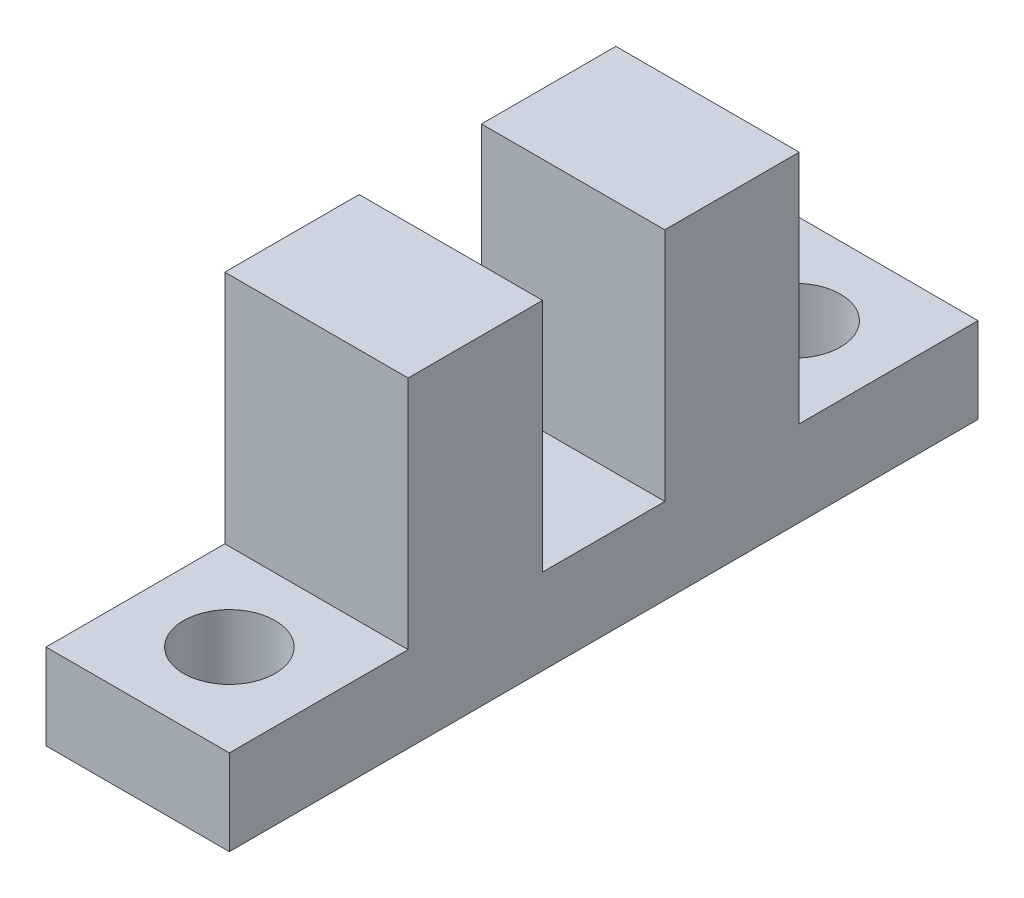
from build123d import *

# Parameters (mm, degrees)
EXTRUDE_1_DEPTH     = 6
SKETCH_2_R          = 1.5
CUT_EXTRUDE_1_DEPTH = 16.663731995


with BuildPart() as part:
    # 草圖1 → 填料-伸長1 (new body)
    with BuildSketch(Plane(origin=(0, 0, 0), x_dir=(0, 0, -1), z_dir=(1, 0, 0))):
        Polygon((-12.25, 0), (12.25, 0), (12.25, 2.8), (6.4, 2.8), (6.4, 10.5), (2, 10.5), (2, 2.8), (-2, 2.8), (-2, 10.5), (-6.4, 10.5), (-6.4, 2.8), (-12.25, 2.8), align=None)
    extrude(amount=EXTRUDE_1_DEPTH)

    # 草圖2 → 除料-伸長1 (cut, through all)
    with BuildSketch(Plane(origin=(0, 2.8, 0), x_dir=(1, 0, 0), z_dir=(0, 1, 0))):
        with Locations(Location((3, 9.25, 0), (0, 0, 270))):
            Circle(SKETCH_2_R)
    cut_extrude_1 = extrude(amount=-CUT_EXTRUDE_1_DEPTH, mode=Mode.SUBTRACT)

    # 鏡射1: 除料-伸長1 across plane
    add(cut_extrude_1.mirror(Plane.XY), mode=Mode.SUBTRACT)


solid = part.part
